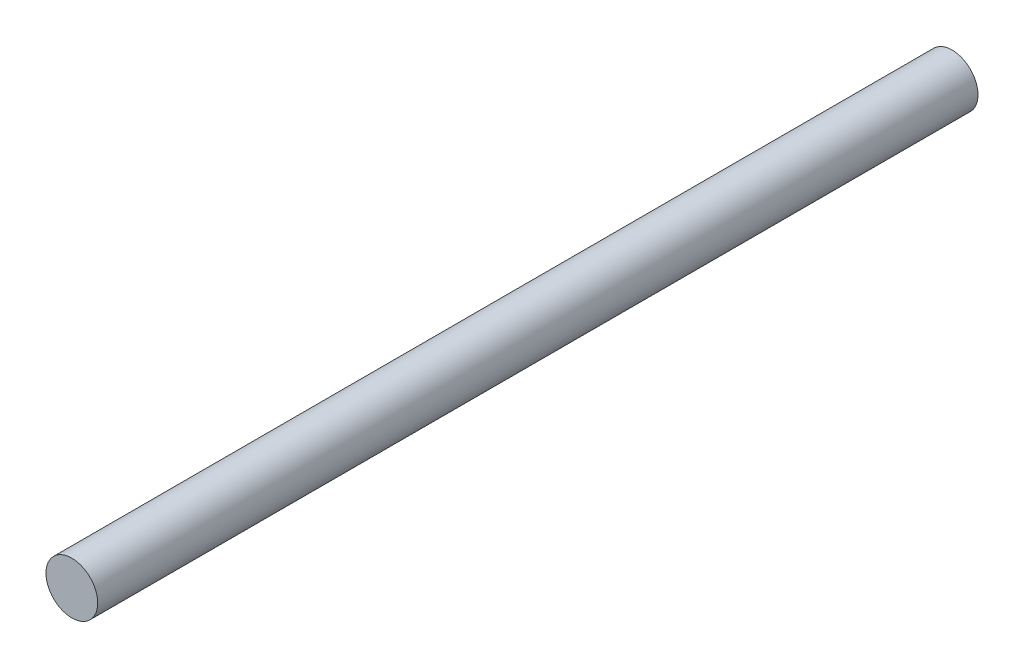
from build123d import *

# Parameters (mm, degrees)
SKETCH_1_R      = 4
EXTRUDE_1_DEPTH = 136


with BuildPart() as part:
    # 草图1 → 凸台-拉伸1 (new body)
    with BuildSketch(Plane.XY):
        Circle(SKETCH_1_R)
    extrude(amount=EXTRUDE_1_DEPTH)


solid = part.part
